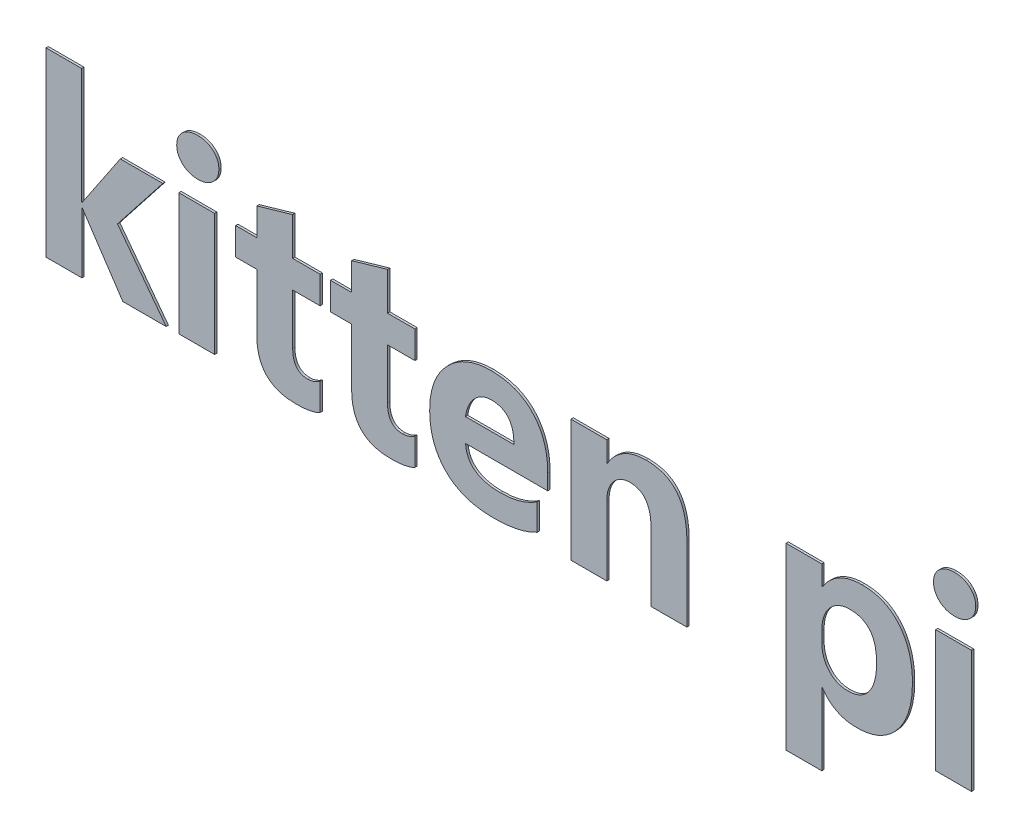
from build123d import *

# Parameters (mm, degrees)
EXTRUDE_1_DEPTH    = 0.2
EXTRUDE_1_2_DEPTH  = 0.2
SKETCH_1_W         = 3.109756098
SKETCH_1_H         = 10.609756097
EXTRUDE_1_3_DEPTH  = 0.2
EXTRUDE_1_4_DEPTH  = 0.2
EXTRUDE_1_5_DEPTH  = 0.2
EXTRUDE_1_6_DEPTH  = 0.2
EXTRUDE_1_7_DEPTH  = 0.2
EXTRUDE_1_8_DEPTH  = 0.2
EXTRUDE_1_9_DEPTH  = 0.2
SKETCH_1_W_2       = 3.109756097
EXTRUDE_1_10_DEPTH = 0.2


with BuildPart() as part:
    # 草图1 → 凸台-拉伸1 (new body)
    with BuildSketch(Plane.XY.offset(138.817561475)):
        Polygon((-38.447698421, -10.339387724), (-42.209131348, -10.339387724), (-45.72761458, -5.063091993), (-45.764771592, -5.063091993), (-45.764771592, -10.339387724), (-48.874527689, -10.339387724), (-48.874527689, 5.392319593), (-45.776204519, 5.392319593), (-45.776204519, -4.660081322), (-45.739047507, -4.660081322), (-42.429215189, 0.270368373), (-38.736379824, 0.270368373), (-42.669306653, -4.737253578), align=None)
    extrude(amount=-EXTRUDE_1_DEPTH)


with BuildPart() as body_2:
    # 草图1 → Extrude 1 2 (new body)
    with BuildSketch(Plane.XY.offset(138.817561475)):
        with BuildLine():
            add(Edge.make_bspline(
                [(-37.533064275, 3.760269288), (-37.527793065, 3.876332794), (-37.517568192, 4.10146796), (-37.415741503, 4.420583029), (-37.252540256, 4.704931677), (-37.025870746, 4.947815692), (-36.753382197, 5.14854085), (-36.436165517, 5.289241499), (-36.084937698, 5.377904731), (-35.837742612, 5.387396056), (-35.709512446, 5.392319593)],
                knots=[0, 0, 0, 0, 1.013028915, 1.965031382, 2.898897403, 3.860779748, 4.851395127, 5.840219378, 6.879633759, 8, 8, 8, 8], degree=3))
            add(Edge.make_bspline(
                [(-35.709512446, 5.392319593), (-35.578403805, 5.387636312), (-35.326225625, 5.378628352), (-34.968600135, 5.287265331), (-34.649901505, 5.140862442), (-34.378289993, 4.935473843), (-34.153048615, 4.690931271), (-33.989460275, 4.40836038), (-33.891026163, 4.093440925), (-33.880130213, 3.873407139), (-33.874527689, 3.760269288)],
                knots=[0, 0, 0, 0, 1.142627177, 2.19776242, 3.198786164, 4.185327788, 5.151100774, 6.082777914, 7.014195085, 8, 8, 8, 8], degree=3))
            add(Edge.make_bspline(
                [(-33.874527689, 3.760269288), (-33.879966617, 3.646136906), (-33.890602004, 3.422960167), (-33.992533714, 3.103593654), (-34.158672097, 2.81541892), (-34.387048152, 2.564529128), (-34.661604816, 2.354634141), (-34.981768535, 2.209535526), (-35.333213357, 2.11237743), (-35.581145767, 2.103982915), (-35.709512446, 2.099636666)],
                knots=[0, 0, 0, 0, 0.988219534, 1.93238422, 2.877019531, 3.854909869, 4.858781534, 5.853896348, 6.888857669, 8, 8, 8, 8], degree=3))
            add(Edge.make_bspline(
                [(-35.709512446, 2.099636666), (-35.835952157, 2.104092585), (-36.081013907, 2.112728918), (-36.430197106, 2.209486167), (-36.7477001, 2.357322698), (-37.021871205, 2.568191321), (-37.24815402, 2.820906871), (-37.414493791, 3.108479498), (-37.517065051, 3.425735516), (-37.52765071, 3.647075035), (-37.533064275, 3.760269288)],
                knots=[0, 0, 0, 0, 1.099806221, 2.131612243, 3.134962962, 4.136936871, 5.125630748, 6.074715084, 7.015398662, 8, 8, 8, 8], degree=3))
        make_face()
    extrude(amount=-EXTRUDE_1_2_DEPTH)


with BuildPart() as body_3:
    # 草图1 → Extrude 1 3 (new body)
    with BuildSketch(Plane.XY.offset(138.817561475)):
        with Locations((-35.795259397, -5.034509675)):
            Rectangle(SKETCH_1_W, SKETCH_1_H)
    extrude(amount=-EXTRUDE_1_3_DEPTH)


with BuildPart() as body_4:
    # 草图1 → Extrude 1 4 (new body)
    with BuildSketch(Plane.XY.offset(138.817561475)):
        with BuildLine():
            add(Edge.make_bspline(
                [(-25.094039885, -10.13073681), (-25.155435721, -10.162369338), (-25.283087957, -10.228138669), (-25.492861574, -10.307527509), (-25.726061646, -10.37127979), (-25.97930136, -10.429378261), (-26.256277421, -10.472209083), (-26.555214831, -10.497896103), (-26.876294162, -10.520454944), (-27.097613906, -10.521680961), (-27.21198958, -10.522314554)],
                knots=[0, 0, 0, 0, 0.761696877, 1.583695493, 2.468947675, 3.427976475, 4.449510619, 5.558414487, 6.738214754, 8, 8, 8, 8], degree=3))
            add(Edge.make_bspline(
                [(-27.21198958, -10.522314554), (-27.34832842, -10.519503433), (-27.61209463, -10.514064935), (-27.995559688, -10.47412012), (-28.35221897, -10.406081167), (-28.683931516, -10.312287851), (-28.988699261, -10.190277525), (-29.26531108, -10.036102562), (-29.518225284, -9.860002488), (-29.743889538, -9.654361322), (-29.942601845, -9.420924533), (-30.113655121, -9.159021271), (-30.261573552, -8.871406646), (-30.376041809, -8.55439276), (-30.47235301, -8.21299208), (-30.536480685, -7.843342721), (-30.572814732, -7.446640907), (-30.578769167, -7.173497944), (-30.581844763, -7.032413639)],
                knots=[0, 0, 0, 0, 1.175744855, 2.274639886, 3.320521789, 4.303609448, 5.243546134, 6.144607315, 7.029144268, 7.8958302, 8.770156038, 9.665805842, 10.588195114, 11.552805878, 12.567526904, 13.644232289, 14.783194536, 16, 16, 16, 16], degree=3))
            Line((-30.581844763, -7.032413639), (-30.581844763, -2.107680407))
            Line((-30.581844763, -2.107680407), (-32.411113055, -2.107680407))
            Line((-32.411113055, -2.107680407), (-32.411113055, 0.270368373))
            Line((-32.411113055, 0.270368373), (-30.581844763, 0.270368373))
            Line((-30.581844763, 0.270368373), (-30.581844763, 2.659850081))
            Line((-30.581844763, 2.659850081), (-27.472088665, 3.5630513))
            Line((-27.472088665, 3.5630513), (-27.472088665, 0.270368373))
            Line((-27.472088665, 0.270368373), (-25.094039885, 0.270368373))
            Line((-25.094039885, 0.270368373), (-25.094039885, -2.107680407))
            Line((-25.094039885, -2.107680407), (-27.472088665, -2.107680407))
            Line((-27.472088665, -2.107680407), (-27.472088665, -6.483633151))
            add(Edge.make_bspline(
                [(-27.472088665, -6.483633151), (-27.469096024, -6.613524386), (-27.463465575, -6.857905811), (-27.400261012, -7.198882998), (-27.300024635, -7.491473488), (-27.152915945, -7.731281453), (-26.962812318, -7.920637181), (-26.728294875, -8.053559337), (-26.451767925, -8.13155335), (-26.255009913, -8.139885857), (-26.151585616, -8.144265773)],
                knots=[0, 0, 0, 0, 1.285741094, 2.41903344, 3.422498945, 4.334225336, 5.182120761, 6.053401136, 6.976785664, 8, 8, 8, 8], degree=3))
            add(Edge.make_bspline(
                [(-26.151585616, -8.144265773), (-26.065404214, -8.139653713), (-25.888535554, -8.130188458), (-25.623592221, -8.056760472), (-25.354242515, -7.941373498), (-25.183210584, -7.834258516), (-25.094039885, -7.778412115)],
                knots=[0, 0, 0, 0, 0.910495551, 1.8685949, 2.888752047, 4, 4, 4, 4], degree=3))
            Line((-25.094039885, -7.778412115), (-25.094039885, -10.13073681))
        make_face()
    extrude(amount=-EXTRUDE_1_4_DEPTH)


with BuildPart() as body_5:
    # 草图1 → Extrude 1 5 (new body)
    with BuildSketch(Plane.XY.offset(138.817561475)):
        with BuildLine():
            add(Edge.make_bspline(
                [(-16.862332567, -10.13073681), (-16.923728404, -10.162369338), (-17.05138064, -10.228138669), (-17.261154257, -10.307527509), (-17.494354329, -10.37127979), (-17.747594043, -10.429378261), (-18.024570104, -10.472209083), (-18.323507513, -10.497896103), (-18.644586845, -10.520454944), (-18.865906589, -10.521680961), (-18.980282263, -10.522314554)],
                knots=[0, 0, 0, 0, 0.761696877, 1.583695493, 2.468947675, 3.427976475, 4.449510619, 5.558414487, 6.738214754, 8, 8, 8, 8], degree=3))
            add(Edge.make_bspline(
                [(-18.980282263, -10.522314554), (-19.116621103, -10.519503433), (-19.380387313, -10.514064935), (-19.763852371, -10.47412012), (-20.120511653, -10.406081167), (-20.452224199, -10.312287851), (-20.756991944, -10.190277525), (-21.033603763, -10.036102562), (-21.286517967, -9.860002488), (-21.512182221, -9.654361322), (-21.710894528, -9.420924533), (-21.881947804, -9.159021271), (-22.029866235, -8.871406646), (-22.144334492, -8.55439276), (-22.240645693, -8.21299208), (-22.304773368, -7.843342721), (-22.341107415, -7.446640907), (-22.34706185, -7.173497944), (-22.350137446, -7.032413639)],
                knots=[0, 0, 0, 0, 1.175744855, 2.274639886, 3.320521789, 4.303609448, 5.243546134, 6.144607315, 7.029144268, 7.8958302, 8.770156038, 9.665805842, 10.588195114, 11.552805878, 12.567526904, 13.644232289, 14.783194536, 16, 16, 16, 16], degree=3))
            Line((-22.350137446, -7.032413639), (-22.350137446, -2.107680407))
            Line((-22.350137446, -2.107680407), (-24.179405738, -2.107680407))
            Line((-24.179405738, -2.107680407), (-24.179405738, 0.270368373))
            Line((-24.179405738, 0.270368373), (-22.350137446, 0.270368373))
            Line((-22.350137446, 0.270368373), (-22.350137446, 2.659850081))
            Line((-22.350137446, 2.659850081), (-19.240381348, 3.5630513))
            Line((-19.240381348, 3.5630513), (-19.240381348, 0.270368373))
            Line((-19.240381348, 0.270368373), (-16.862332567, 0.270368373))
            Line((-16.862332567, 0.270368373), (-16.862332567, -2.107680407))
            Line((-16.862332567, -2.107680407), (-19.240381348, -2.107680407))
            Line((-19.240381348, -2.107680407), (-19.240381348, -6.483633151))
            add(Edge.make_bspline(
                [(-19.240381348, -6.483633151), (-19.237388707, -6.613524386), (-19.231758258, -6.857905811), (-19.168553695, -7.198882998), (-19.068317317, -7.491473488), (-18.921208628, -7.731281453), (-18.731105, -7.920637181), (-18.496587558, -8.053559337), (-18.220060608, -8.13155335), (-18.023302596, -8.139885857), (-17.919878299, -8.144265773)],
                knots=[0, 0, 0, 0, 1.285741094, 2.41903344, 3.422498945, 4.334225336, 5.182120761, 6.053401136, 6.976785664, 8, 8, 8, 8], degree=3))
            add(Edge.make_bspline(
                [(-17.919878299, -8.144265773), (-17.833696897, -8.139653713), (-17.656828237, -8.130188458), (-17.391884904, -8.056760472), (-17.122535198, -7.941373498), (-16.951503267, -7.834258516), (-16.862332567, -7.778412115)],
                knots=[0, 0, 0, 0, 0.910495551, 1.8685949, 2.888752047, 4, 4, 4, 4], degree=3))
            Line((-16.862332567, -7.778412115), (-16.862332567, -10.13073681))
        make_face()
    extrude(amount=-EXTRUDE_1_5_DEPTH)


with BuildPart() as body_6:
    # 草图1 → Extrude 1 6 (new body)
    with BuildSketch(Plane.XY.offset(138.817561475)):
        with BuildLine():
            Line((-5.337942324, -6.132070651), (-12.472088665, -6.132070651))
            add(Edge.make_bspline(
                [(-12.472088665, -6.132070651), (-12.463139476, -6.220878917), (-12.44570034, -6.3939381), (-12.39456002, -6.644279129), (-12.319505185, -6.876583907), (-12.225850521, -7.093347991), (-12.107293352, -7.291078813), (-11.969611509, -7.473561388), (-11.808113869, -7.636536672), (-11.626890097, -7.783064942), (-11.42489387, -7.912872146), (-11.201096672, -8.023569933), (-10.95705414, -8.117852096), (-10.692195522, -8.195080142), (-10.405437946, -8.25457823), (-10.096959161, -8.296512236), (-9.767699719, -8.322639424), (-9.541499075, -8.325646647), (-9.425213665, -8.327192602)],
                knots=[0, 0, 0, 0, 1.015145521, 1.978197122, 2.900360333, 3.788577525, 4.658616817, 5.517167919, 6.383349525, 7.26198997, 8.164056139, 9.109374548, 10.097776322, 11.137115112, 12.244757466, 13.426713085, 14.677122588, 16, 16, 16, 16], degree=3))
            add(Edge.make_bspline(
                [(-9.425213665, -8.327192602), (-9.277430024, -8.324542524), (-8.985991376, -8.319316403), (-8.555273638, -8.274955167), (-8.137759412, -8.204267568), (-7.733522404, -8.104161625), (-7.342849699, -7.974774273), (-6.965304848, -7.817539643), (-6.599786634, -7.631751539), (-6.368687983, -7.485859422), (-6.25257647, -7.412558456)],
                knots=[0, 0, 0, 0, 1.058377374, 2.087186842, 3.098093869, 4.08957847, 5.067225908, 6.043156752, 7.016818014, 8, 8, 8, 8], degree=3))
            Line((-6.25257647, -7.412558456), (-6.25257647, -9.702002054))
            add(Edge.make_bspline(
                [(-6.25257647, -9.702002054), (-6.379274749, -9.767882719), (-6.638360573, -9.902602359), (-7.052692326, -10.069165539), (-7.495306841, -10.209462073), (-7.966519577, -10.322502893), (-8.466147619, -10.415363229), (-8.995388169, -10.474675568), (-9.552163158, -10.517980853), (-9.932933648, -10.520844816), (-10.128338665, -10.522314554)],
                knots=[0, 0, 0, 0, 0.855774108, 1.749975933, 2.67310193, 3.637355573, 4.653555908, 5.717748884, 6.828787075, 8, 8, 8, 8], degree=3))
            add(Edge.make_bspline(
                [(-10.128338665, -10.522314554), (-10.338126443, -10.517981789), (-10.746388994, -10.509549908), (-11.339980047, -10.442612868), (-11.898073023, -10.335581659), (-12.421270986, -10.18151508), (-12.90783974, -9.98041301), (-13.361198659, -9.740731387), (-13.776023269, -9.452048015), (-14.152423703, -9.120017455), (-14.492369985, -8.751049691), (-14.783628916, -8.342811146), (-15.03266336, -7.901784615), (-15.231682997, -7.424145988), (-15.388698236, -6.912886577), (-15.50365215, -6.367900906), (-15.568552162, -5.787804426), (-15.57733782, -5.390043018), (-15.581844763, -5.185995956)],
                knots=[0, 0, 0, 0, 1.16165733, 2.260671196, 3.303818612, 4.305571956, 5.275694863, 6.21527167, 7.140378917, 8.067650723, 8.99018096, 9.912756469, 10.838901532, 11.789541144, 12.7726225, 13.797186482, 14.86998181, 16, 16, 16, 16], degree=3))
            add(Edge.make_bspline(
                [(-15.581844763, -5.185995956), (-15.577816628, -4.981901387), (-15.569922564, -4.581930687), (-15.49741877, -3.997230659), (-15.37648737, -3.441803636), (-15.212189294, -2.914316566), (-14.997243529, -2.416623375), (-14.730758934, -1.951039909), (-14.422506396, -1.511259856), (-14.065549248, -1.107183136), (-13.671954813, -0.744027122), (-13.254647236, -0.420062196), (-12.80851585, -0.151241319), (-12.339658943, 0.071087454), (-11.845046248, 0.242782115), (-11.326178215, 0.365895116), (-10.782969821, 0.437578151), (-10.413418873, 0.44799745), (-10.225518543, 0.453295203)],
                knots=[0, 0, 0, 0, 1.12293949, 2.200660688, 3.236384601, 4.248028144, 5.236771467, 6.213680497, 7.195712831, 8.187718402, 9.174708164, 10.139609275, 11.090169674, 12.035465297, 12.990685934, 13.966214811, 14.965910089, 16, 16, 16, 16], degree=3))
            add(Edge.make_bspline(
                [(-10.225518543, 0.453295203), (-10.038569251, 0.448992701), (-9.674897881, 0.440623069), (-9.14501242, 0.373074809), (-8.646914472, 0.266288404), (-8.178998085, 0.11403099), (-7.742090267, -0.083219094), (-7.338321562, -0.327421105), (-6.96487334, -0.613462471), (-6.625801179, -0.9418019), (-6.322779186, -1.308492768), (-6.05745096, -1.708554442), (-5.835044932, -2.142401119), (-5.650058213, -2.608022958), (-5.512865597, -3.108060731), (-5.408474698, -3.638914289), (-5.349039392, -4.203312886), (-5.341701566, -4.590395423), (-5.337942324, -4.788701749)],
                knots=[0, 0, 0, 0, 1.104249554, 2.148090227, 3.150663886, 4.110164358, 5.049842715, 5.976635017, 6.892005388, 7.823572189, 8.759110415, 9.697438902, 10.654161179, 11.63468351, 12.652268729, 13.713212317, 14.828455382, 16, 16, 16, 16], degree=3))
            Line((-5.337942324, -4.788701749), (-5.337942324, -6.132070651))
        make_face()
        with BuildLine():
            add(Edge.make_bspline(
                [(-8.264771592, -4.119875529), (-8.266485224, -4.023595952), (-8.269798781, -3.837425356), (-8.293305208, -3.567350644), (-8.328847526, -3.315787126), (-8.3828676, -3.082163464), (-8.455343042, -2.868979952), (-8.536462196, -2.670379845), (-8.640641915, -2.494895375), (-8.755474141, -2.3343457), (-8.887275558, -2.192995876), (-9.037886322, -2.073257394), (-9.20096446, -1.968873363), (-9.380455356, -1.88677428), (-9.574195808, -1.818836722), (-9.784868087, -1.776215014), (-10.010242512, -1.745307874), (-10.165377082, -1.74301259), (-10.245526165, -1.741826749)],
                knots=[0, 0, 0, 0, 1.304456094, 2.522356003, 3.670740122, 4.744809642, 5.765412085, 6.719770875, 7.645317187, 8.523272605, 9.390916749, 10.253842, 11.124171168, 12.007803081, 12.922299319, 13.899693358, 14.914892718, 16, 16, 16, 16], degree=3))
            add(Edge.make_bspline(
                [(-10.245526165, -1.741826749), (-10.312282464, -1.744571718), (-10.445420578, -1.750046258), (-10.64255159, -1.777142607), (-10.833498931, -1.830916687), (-11.018953071, -1.901208057), (-11.197581545, -1.994285266), (-11.371000395, -2.106996105), (-11.537738973, -2.2408686), (-11.753282459, -2.444596224), (-11.994196696, -2.740564394), (-12.220414219, -3.152523329), (-12.389039164, -3.616596013), (-12.449392787, -3.948110434), (-12.48066336, -4.119875529)],
                knots=[0, 0, 0, 0, 0.675284001, 1.346779852, 2.00565549, 2.676391145, 3.34837031, 4.037590373, 4.764092109, 5.506694688, 7.033445383, 8.598478779, 10.237595168, 12, 12, 12, 12], degree=3))
            Line((-12.48066336, -4.119875529), (-8.264771592, -4.119875529))
        make_face(mode=Mode.SUBTRACT)
    extrude(amount=-EXTRUDE_1_6_DEPTH)


with BuildPart() as body_7:
    # 草图1 → Extrude 1 7 (new body)
    with BuildSketch(Plane.XY.offset(138.817561475)):
        with BuildLine():
            Line((6.735228408, -10.339387724), (3.625472311, -10.339387724))
            Line((3.625472311, -10.339387724), (3.625472311, -4.474296261))
            add(Edge.make_bspline(
                [(3.625472311, -4.474296261), (3.625051045, -4.371332595), (3.624234653, -4.171793808), (3.598755835, -3.883028618), (3.567717218, -3.613127087), (3.514253593, -3.364600925), (3.453370161, -3.133171119), (3.373106072, -2.923275272), (3.281659712, -2.732231579), (3.176180791, -2.560888789), (3.051090144, -2.413006906), (2.918090961, -2.279073402), (2.766856108, -2.169677086), (2.60126255, -2.080488059), (2.422360932, -2.008344375), (2.227686271, -1.961695697), (2.021296221, -1.927607679), (1.878294157, -1.925722647), (1.804778713, -1.924753578)],
                knots=[0, 0, 0, 0, 1.385577933, 2.685185481, 3.900730131, 5.040333697, 6.104607026, 7.119499225, 8.0603568, 8.953669725, 9.819198624, 10.662777709, 11.488914802, 12.321203114, 13.190620345, 14.077277699, 15.011554236, 16, 16, 16, 16], degree=3))
            add(Edge.make_bspline(
                [(1.804778713, -1.924753578), (1.73415587, -1.927119634), (1.594122933, -1.931811115), (1.389145388, -1.963949281), (1.192827869, -2.014299661), (1.007101337, -2.090649004), (0.830257808, -2.188207825), (0.661032458, -2.305305558), (0.502267651, -2.444611592), (0.354648688, -2.603550863), (0.222636015, -2.779999067), (0.102198962, -2.966415248), (0.007184889, -3.168714038), (-0.077452197, -3.379611797), (-0.140398705, -3.603873263), (-0.181053705, -3.839647421), (-0.212370085, -4.085706707), (-0.21476839, -4.254105542), (-0.215991104, -4.339959371)],
                knots=[0, 0, 0, 0, 0.962967614, 1.90939895, 2.82343066, 3.721059163, 4.639881235, 5.573469571, 6.522039335, 7.515047549, 8.526002385, 9.52460601, 10.535811341, 11.568577159, 12.621661098, 13.704858409, 14.829880903, 16, 16, 16, 16], degree=3))
            Line((-0.215991104, -4.339959371), (-0.215991104, -10.339387724))
            Line((-0.215991104, -10.339387724), (-3.325747202, -10.339387724))
            Line((-3.325747202, -10.339387724), (-3.325747202, 0.270368373))
            Line((-3.325747202, 0.270368373), (-0.215991104, 0.270368373))
            Line((-0.215991104, 0.270368373), (-0.215991104, -1.490302358))
            Line((-0.215991104, -1.490302358), (-0.178834092, -1.490302358))
            add(Edge.make_bspline(
                [(-0.178834092, -1.490302358), (-0.080390794, -1.336348198), (0.112042446, -1.03540442), (0.453220309, -0.635403744), (0.8330066, -0.300381838), (1.243503632, -0.021565524), (1.692162883, 0.18911059), (2.171111763, 0.347421579), (2.686735076, 0.434354104), (3.041137899, 0.446884337), (3.22246164, 0.453295203)],
                knots=[0, 0, 0, 0, 1.064617132, 2.081073364, 3.053068974, 4.009833717, 4.963950105, 5.933641332, 6.942785272, 8, 8, 8, 8], degree=3))
            add(Edge.make_bspline(
                [(3.22246164, 0.453295203), (3.36461514, 0.450344837), (3.640380642, 0.444621384), (4.039908777, 0.390655188), (4.413836803, 0.3112552), (4.758052567, 0.189163481), (5.077322579, 0.038036704), (5.366299218, -0.152090828), (5.62957159, -0.374445084), (5.865297771, -0.630417965), (6.072300109, -0.921585544), (6.248274037, -1.247171537), (6.401984663, -1.604224817), (6.521886402, -1.99688833), (6.620425326, -2.422569146), (6.686961348, -2.882417025), (6.726984318, -3.376019241), (6.732421936, -3.715832195), (6.735228408, -3.891216993)],
                knots=[0, 0, 0, 0, 1.067420533, 2.070703575, 3.024128503, 3.934192378, 4.808213066, 5.671854353, 6.525140104, 7.391387901, 8.279251406, 9.20186848, 10.167150257, 11.194978914, 12.281972813, 13.447160288, 14.682424336, 16, 16, 16, 16], degree=3))
            Line((6.735228408, -3.891216993), (6.735228408, -10.339387724))
        make_face()
    extrude(amount=-EXTRUDE_1_7_DEPTH)


with BuildPart() as body_8:
    # 草图1 → Extrude 1 8 (new body)
    with BuildSketch(Plane.XY.offset(138.817561475)):
        with BuildLine():
            Line((18.442545481, -8.99316059), (18.442545481, -15.278412115))
            Line((18.442545481, -15.278412115), (15.332789384, -15.278412115))
            Line((15.332789384, -15.278412115), (15.332789384, 0.270368373))
            Line((15.332789384, 0.270368373), (18.442545481, 0.270368373))
            Line((18.442545481, 0.270368373), (18.442545481, -1.424563029))
            Line((18.442545481, -1.424563029), (18.482560725, -1.424563029))
            add(Edge.make_bspline(
                [(18.482560725, -1.424563029), (18.586676035, -1.275078236), (18.789906868, -0.98328715), (19.149252091, -0.599665241), (19.539739073, -0.275191973), (19.960612252, -0.004626867), (20.415505478, 0.201499619), (20.901916306, 0.347345874), (21.419295768, 0.438660958), (21.775808594, 0.448342792), (21.958170481, 0.453295203)],
                knots=[0, 0, 0, 0, 1.056849941, 2.062948242, 3.041278237, 3.999052788, 4.959747512, 5.931168975, 6.941760571, 8, 8, 8, 8], degree=3))
            add(Edge.make_bspline(
                [(21.958170481, 0.453295203), (22.12417303, 0.448923449), (22.44800221, 0.440395258), (22.919230644, 0.373459607), (23.362781946, 0.264871789), (23.780142452, 0.114181842), (24.168214304, -0.084861201), (24.52809955, -0.326478268), (24.860039451, -0.612518713), (25.16048443, -0.941450675), (25.434040362, -1.304659943), (25.667507707, -1.703619318), (25.866091512, -2.133543183), (26.02844449, -2.593855954), (26.15388264, -3.086690366), (26.244444723, -3.609317357), (26.299929478, -4.164405363), (26.305523789, -4.544666206), (26.30839914, -4.74011181)],
                knots=[0, 0, 0, 0, 1.04010012, 2.028973478, 2.976132012, 3.897993826, 4.803307456, 5.702594751, 6.608695748, 7.542604536, 8.489650127, 9.453322789, 10.433813335, 11.453661627, 12.50801094, 13.617335719, 14.775363625, 16, 16, 16, 16], degree=3))
            add(Edge.make_bspline(
                [(26.30839914, -4.74011181), (26.304967944, -4.953685767), (26.298273521, -5.370378529), (26.234188915, -5.979170747), (26.128952284, -6.554396801), (25.984094524, -7.098311907), (25.794241795, -7.608690084), (25.566471585, -8.088686571), (25.292916365, -8.534862791), (24.978786903, -8.9439051), (24.635652455, -9.317224222), (24.25847614, -9.637642961), (23.858376139, -9.913107795), (23.430559295, -10.137127973), (22.975239895, -10.308991115), (22.494105414, -10.431849484), (21.987236767, -10.507505548), (21.640217393, -10.517321433), (21.463696396, -10.522314554)],
                knots=[0, 0, 0, 0, 1.208351971, 2.357551107, 3.459510827, 4.515009193, 5.538598813, 6.537013342, 7.517223534, 8.494255124, 9.451826623, 10.381110197, 11.288887612, 12.195687742, 13.106949184, 14.036748796, 15.001338002, 16, 16, 16, 16], degree=3))
            add(Edge.make_bspline(
                [(21.463696396, -10.522314554), (21.304298841, -10.518431588), (20.99427581, -10.510879348), (20.54423126, -10.437542198), (20.123329179, -10.318103929), (19.732397067, -10.148500141), (19.370553773, -9.931968293), (19.039808229, -9.666777276), (18.739586798, -9.352718879), (18.569298096, -9.114499022), (18.482560725, -8.99316059)],
                knots=[0, 0, 0, 0, 1.09146153, 2.122856979, 3.114629619, 4.08241359, 5.03405578, 5.995477624, 6.978986876, 8, 8, 8, 8], degree=3))
            Line((18.482560725, -8.99316059), (18.442545481, -8.99316059))
        make_face()
        with BuildLine():
            add(Edge.make_bspline(
                [(18.442545481, -5.634738334), (18.443573216, -5.724415676), (18.445591769, -5.900549217), (18.479805973, -6.158235191), (18.526371186, -6.404443507), (18.595671598, -6.637957953), (18.684580774, -6.857574168), (18.790180339, -7.066824348), (18.920611454, -7.260132769), (19.064911371, -7.44359424), (19.226997302, -7.608312581), (19.402112666, -7.752395173), (19.588995749, -7.873510611), (19.788114044, -7.970893555), (19.997915599, -8.048006499), (20.21855566, -8.106750043), (20.451992324, -8.137009368), (20.61091612, -8.141814803), (20.691973835, -8.144265773)],
                knots=[0, 0, 0, 0, 1.137452891, 2.234049312, 3.294294807, 4.316039401, 5.319947854, 6.298997206, 7.285191911, 8.274939949, 9.25846123, 10.212387043, 11.148356456, 12.078682727, 13.020028408, 13.982198932, 14.970837925, 16, 16, 16, 16], degree=3))
            add(Edge.make_bspline(
                [(20.691973835, -8.144265773), (20.788335059, -8.141403994), (20.976199935, -8.135824699), (21.249658883, -8.095809405), (21.506887652, -8.026982263), (21.747425682, -7.929251019), (21.972918717, -7.80595723), (22.180525228, -7.653051267), (22.369123654, -7.470405817), (22.544616135, -7.265083345), (22.698410084, -7.032051273), (22.832827463, -6.776260995), (22.948071953, -6.498206365), (23.037318052, -6.195725797), (23.113116155, -5.872655494), (23.163555571, -5.52558432), (23.190995274, -5.155957614), (23.19604532, -4.902123532), (23.198643042, -4.771552358)],
                knots=[0, 0, 0, 0, 0.973837434, 1.89858369, 2.786284016, 3.65897008, 4.516703433, 5.37767434, 6.256344124, 7.165106906, 8.102602015, 9.071857557, 10.082290522, 11.139373483, 12.256015522, 13.434087785, 14.680105649, 16, 16, 16, 16], degree=3))
            add(Edge.make_bspline(
                [(23.198643042, -4.771552358), (23.197419155, -4.656197749), (23.195058255, -4.433676803), (23.165079107, -4.111109448), (23.120126008, -3.81027654), (23.058317723, -3.530987937), (22.978435435, -3.273132384), (22.878269637, -3.038810641), (22.761526571, -2.824764191), (22.623421503, -2.635206541), (22.467369475, -2.467941223), (22.295496156, -2.321024475), (22.104625979, -2.196464432), (21.894720132, -2.096953491), (21.666560028, -2.01882402), (21.419807315, -1.966630356), (21.156058105, -1.930582547), (20.97411563, -1.926732223), (20.880617128, -1.924753578)],
                knots=[0, 0, 0, 0, 1.318360219, 2.543138626, 3.700020661, 4.794021901, 5.81026981, 6.781386741, 7.702855861, 8.591754809, 9.454922348, 10.312643545, 11.170641337, 12.052438092, 12.961789338, 13.92110641, 14.931676422, 16, 16, 16, 16], degree=3))
            add(Edge.make_bspline(
                [(20.880617128, -1.924753578), (20.7928392, -1.926692346), (20.620268666, -1.930503944), (20.36799508, -1.968128537), (20.128960367, -2.032067599), (19.901051354, -2.117424547), (19.686668301, -2.229591104), (19.484137166, -2.365323763), (19.294600658, -2.526721787), (19.11969139, -2.711652238), (18.959014819, -2.91330695), (18.821973037, -3.13272332), (18.703123157, -3.364411441), (18.610804438, -3.612823127), (18.53064527, -3.872394942), (18.482234146, -4.148000314), (18.449066435, -4.436328464), (18.444757165, -4.633301291), (18.442545481, -4.734395346)],
                knots=[0, 0, 0, 0, 1.009771242, 1.985200223, 2.926758463, 3.853384691, 4.780335265, 5.704882978, 6.654009165, 7.639006215, 8.630573228, 9.616241444, 10.611741701, 11.621810592, 12.662658964, 13.733683102, 14.836838728, 16, 16, 16, 16], degree=3))
            Line((18.442545481, -4.734395346), (18.442545481, -5.634738334))
        make_face(mode=Mode.SUBTRACT)
    extrude(amount=-EXTRUDE_1_8_DEPTH)


with BuildPart() as body_9:
    # 草图1 → Extrude 1 9 (new body)
    with BuildSketch(Plane.XY.offset(138.817561475)):
        with BuildLine():
            add(Edge.make_bspline(
                [(28.137667433, 3.760269288), (28.142938642, 3.876332794), (28.153163515, 4.10146796), (28.254990204, 4.420583029), (28.418191451, 4.704931677), (28.644860962, 4.947815692), (28.91734951, 5.14854085), (29.234566191, 5.289241499), (29.585794009, 5.377904731), (29.832989095, 5.387396056), (29.961219262, 5.392319593)],
                knots=[0, 0, 0, 0, 1.013028915, 1.965031382, 2.898897403, 3.860779748, 4.851395127, 5.840219378, 6.879633759, 8, 8, 8, 8], degree=3))
            add(Edge.make_bspline(
                [(29.961219262, 5.392319593), (30.092327902, 5.387636312), (30.344506083, 5.378628352), (30.702131572, 5.287265331), (31.020830203, 5.140862442), (31.292441714, 4.935473843), (31.517683092, 4.690931271), (31.681271432, 4.40836038), (31.779705544, 4.093440925), (31.790601495, 3.873407139), (31.796204018, 3.760269288)],
                knots=[0, 0, 0, 0, 1.142627177, 2.19776242, 3.198786164, 4.185327788, 5.151100774, 6.082777914, 7.014195085, 8, 8, 8, 8], degree=3))
            add(Edge.make_bspline(
                [(31.796204018, 3.760269288), (31.790765091, 3.646136906), (31.780129703, 3.422960167), (31.678197993, 3.103593654), (31.51205961, 2.81541892), (31.283683555, 2.564529128), (31.009126891, 2.354634141), (30.688963172, 2.209535526), (30.33751835, 2.11237743), (30.08958594, 2.103982915), (29.961219262, 2.099636666)],
                knots=[0, 0, 0, 0, 0.988219534, 1.93238422, 2.877019531, 3.854909869, 4.858781534, 5.853896348, 6.888857669, 8, 8, 8, 8], degree=3))
            add(Edge.make_bspline(
                [(29.961219262, 2.099636666), (29.83477955, 2.104092585), (29.589717801, 2.112728918), (29.240534602, 2.209486167), (28.923031608, 2.357322698), (28.648860502, 2.568191321), (28.422577687, 2.820906871), (28.256237916, 3.108479498), (28.153666657, 3.425735516), (28.143080997, 3.647075035), (28.137667433, 3.760269288)],
                knots=[0, 0, 0, 0, 1.099806221, 2.131612243, 3.134962962, 4.136936871, 5.125630748, 6.074715084, 7.015398662, 8, 8, 8, 8], degree=3))
        make_face()
    extrude(amount=-EXTRUDE_1_9_DEPTH)


with BuildPart() as body_10:
    # 草图1 → Extrude 1 10 (new body)
    with BuildSketch(Plane.XY.offset(138.817561475)):
        with Locations((29.875472311, -5.034509675)):
            Rectangle(SKETCH_1_W_2, SKETCH_1_H)
    extrude(amount=-EXTRUDE_1_10_DEPTH)


solid = Compound([part.part, body_2.part, body_3.part, body_4.part, body_5.part, body_6.part, body_7.part, body_8.part, body_9.part, body_10.part])
